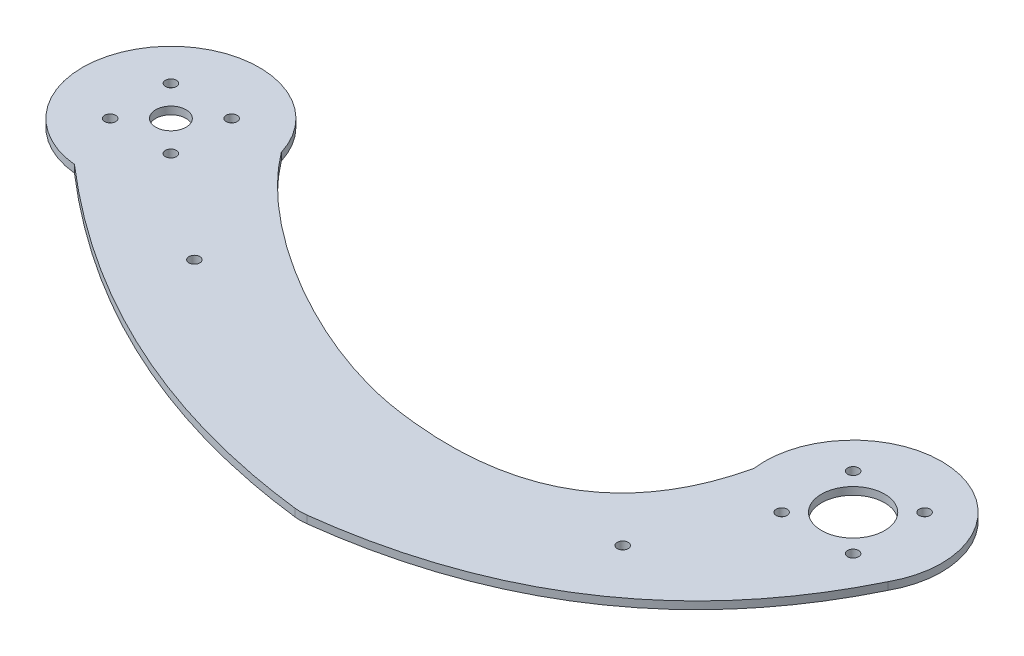
from build123d import *

# Parameters (mm, degrees)
SKETCH2_R           = 1.09
SKETCH2_R_2         = 3
SKETCH2_R_3         = 6.25
BOSS_EXTRUDE1_DEPTH = 1.5
FILLET1_R           = 10
SKETCH3_R           = 1.09
CUT_EXTRUDE1_DEPTH  = 10


with BuildPart() as part:
    # Sketch2 → Boss-Extrude1 (new body)
    with BuildSketch(Plane(origin=(0, 0, 0), x_dir=(1, 0, 0), z_dir=(0, 1, 0))):
        with BuildLine():
            add(Edge.make_bspline(
                [(15.330967743, -8.438686395), (-4.328656702, -48.917065398), (-54.77019988, -54.651995587)],
                knots=[0, 0, 0, 1, 1, 1], degree=2))
            ThreePointArc((15.330967743, -8.438686395), (3.221708095, 17.200889423), (-17.345753159, -2.318371704))
            add(Edge.make_bspline(
                [(-17.345753159, -2.318371704), (-24.57230847, -34.004755189), (-64.372079348, -27.287713928)],
                knots=[0, 0, 0, 1, 1, 1], degree=2))
            add(Edge.make_bspline(
                [(-118.261066558, 5.104714216), (-107.65521746, -9.024230402), (-84.042514499, -23.671917894), (-64.372079348, -27.287713928)],
                knots=[0, 0, 0, 0, 1, 1, 1, 1], degree=3))
            ThreePointArc((-118.261066558, 5.104714216), (-148.55197352, 11.072218102), (-136.664707239, -17.420641487))
            add(Edge.make_bspline(
                [(-136.664707239, -17.420641487), (-99.493020923, -49.665084924), (-54.77019988, -54.651995587)],
                knots=[0, 0, 0, 1, 1, 1], degree=2))
        make_face()
        with Locations(Location((-141.01040764, -6.01040764, 0), (0, 0, 270))):
            Circle(SKETCH2_R, mode=Mode.SUBTRACT)
        with Locations(Location((-128.98959236, -6.01040764, 0), (0, 0, 270))):
            Circle(SKETCH2_R, mode=Mode.SUBTRACT)
        with Locations(Location((-135, 0, 0), (0, 0, 270))):
            Circle(SKETCH2_R_2, mode=Mode.SUBTRACT)
        with Locations(Location((-141.01040764, 6.01040764, 0), (0, 0, 270))):
            Circle(SKETCH2_R, mode=Mode.SUBTRACT)
        with Locations(Location((-128.98959236, 6.01040764, 0), (0, 0, 270))):
            Circle(SKETCH2_R, mode=Mode.SUBTRACT)
        with Locations(Location((-7.071067812, -7.071067812, 0), (0, 0, 270))):
            Circle(SKETCH2_R, mode=Mode.SUBTRACT)
        with Locations(Location((7.071067812, -7.071067812, 0), (0, 0, 270))):
            Circle(SKETCH2_R, mode=Mode.SUBTRACT)
        with Locations(Location((-7.071067812, 7.071067812, 0), (0, 0, 270))):
            Circle(SKETCH2_R, mode=Mode.SUBTRACT)
        with Locations(Location((0, 0, 0), (0, 0, 270))):
            Circle(SKETCH2_R_3, mode=Mode.SUBTRACT)
        with Locations(Location((7.071067812, 7.071067812, 0), (0, 0, 270))):
            Circle(SKETCH2_R, mode=Mode.SUBTRACT)
    extrude(amount=BOSS_EXTRUDE1_DEPTH)

    # Fillet1
    fillet1_edges = [part.edges().sort_by_distance(p)[0] for p in [
        (-54.77019988, 0.75, 54.651995587),
    ]]
    fillet(fillet1_edges, radius=FILLET1_R)

    # Sketch3 → Cut-Extrude1 (cut)
    with BuildSketch(Plane(origin=(0, 1.5, 0), x_dir=(1, 0, 0), z_dir=(0, 1, 0))):
        with Locations(Location((-17.11634733, -28.475205037, 0), (0, 0, 270))):
            Circle(SKETCH3_R)
        with Locations(Location((-108.461839112, -21.891809685, 0), (0, 0, 270))):
            Circle(SKETCH3_R)
    extrude(amount=-CUT_EXTRUDE1_DEPTH, mode=Mode.SUBTRACT)


solid = part.part
